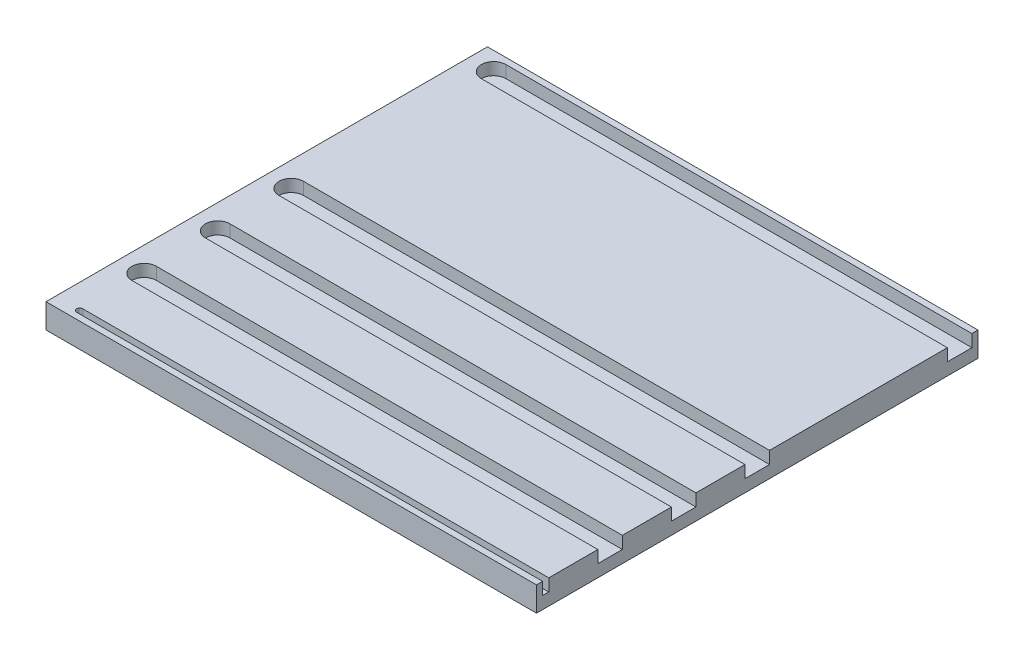
from build123d import *

# Parameters (mm, degrees)
BOSS_EXTRUDE1_DEPTH = 6.35
BOSS_EXTRUDE2_DEPTH = 3.175


with BuildPart() as part:
    # Sketch1 → Boss-Extrude1 (new body)
    with BuildSketch(Plane(origin=(0, 0, 0), x_dir=(1, 0, 0), z_dir=(0, 1, 0))):
        with BuildLine():
            Line((0, 114.3), (0, 0))
            Line((0, 0), (127, 0))
            Line((127, 0), (127, 1.5875))
            Line((127, 1.5875), (6.35, 1.5875))
            ThreePointArc((6.35, 1.5875), (5.55625, 2.38125), (6.35, 3.175))
            Line((6.35, 3.175), (127, 3.175))
            Line((127, 3.175), (127, 15.875))
            Line((127, 15.875), (6.35, 15.875))
            ThreePointArc((6.35, 15.875), (3.175, 19.05), (6.35, 22.225))
            Line((6.35, 22.225), (127, 22.225))
            Line((127, 22.225), (127, 34.925))
            Line((127, 34.925), (6.35, 34.925))
            ThreePointArc((6.35, 34.925), (3.175, 38.1), (6.35, 41.275))
            Line((6.35, 41.275), (127, 41.275))
            Line((127, 41.275), (127, 53.975))
            Line((127, 53.975), (6.35, 53.975))
            ThreePointArc((6.35, 53.975), (3.175, 57.15), (6.35, 60.325))
            Line((6.35, 60.325), (127, 60.325))
            Line((127, 60.325), (127, 106.3625))
            Line((127, 106.3625), (6.35, 106.3625))
            ThreePointArc((6.35, 106.3625), (3.175, 109.5375), (6.35, 112.7125))
            Line((6.35, 112.7125), (127, 112.7125))
            Line((127, 112.7125), (127, 114.3))
            Line((127, 114.3), (0, 114.3))
        make_face()
    extrude(amount=BOSS_EXTRUDE1_DEPTH)

    # Sketch1<3> → Boss-Extrude2 (add)
    with BuildSketch(Plane(origin=(0, 0, 0), x_dir=(1, 0, 0), z_dir=(0, 1, 0))):
        with BuildLine():
            Line((6.35, 1.5875), (127, 1.5875))
            Line((127, 1.5875), (127, 3.175))
            Line((127, 3.175), (6.35, 3.175))
            ThreePointArc((6.35, 3.175), (5.55625, 2.38125), (6.35, 1.5875))
        make_face()
        with BuildLine():
            Line((127, 106.3625), (127, 112.7125))
            Line((127, 112.7125), (6.35, 112.7125))
            ThreePointArc((6.35, 112.7125), (3.175, 109.5375), (6.35, 106.3625))
            Line((6.35, 106.3625), (127, 106.3625))
        make_face()
        with BuildLine():
            Line((6.35, 15.875), (127, 15.875))
            Line((127, 15.875), (127, 22.225))
            Line((127, 22.225), (6.35, 22.225))
            ThreePointArc((6.35, 22.225), (3.175, 19.05), (6.35, 15.875))
        make_face()
        with BuildLine():
            Line((127, 53.975), (127, 60.325))
            Line((127, 60.325), (6.35, 60.325))
            ThreePointArc((6.35, 60.325), (3.175, 57.15), (6.35, 53.975))
            Line((6.35, 53.975), (127, 53.975))
        make_face()
        with BuildLine():
            Line((6.35, 34.925), (127, 34.925))
            Line((127, 34.925), (127, 41.275))
            Line((127, 41.275), (6.35, 41.275))
            ThreePointArc((6.35, 41.275), (3.175, 38.1), (6.35, 34.925))
        make_face()
    extrude(amount=BOSS_EXTRUDE2_DEPTH)


solid = part.part
